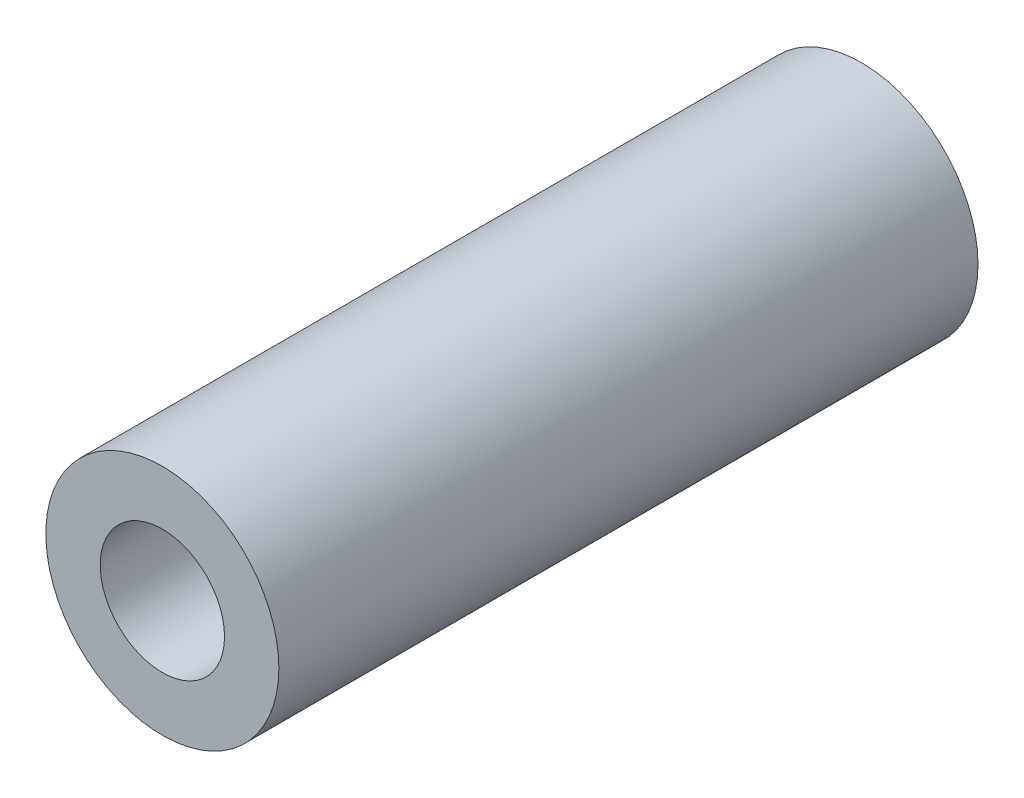
from build123d import *

# Parameters (mm, degrees)
SKETCH_1_R      = 3
SKETCH_1_R_2    = 1.6
EXTRUDE_1_DEPTH = 18


with BuildPart() as part:
    # 草图1 → 凸台-拉伸1 (new body)
    with BuildSketch(Plane.XY):
        Circle(SKETCH_1_R)
        Circle(SKETCH_1_R_2, mode=Mode.SUBTRACT)
    extrude(amount=EXTRUDE_1_DEPTH)


solid = part.part
